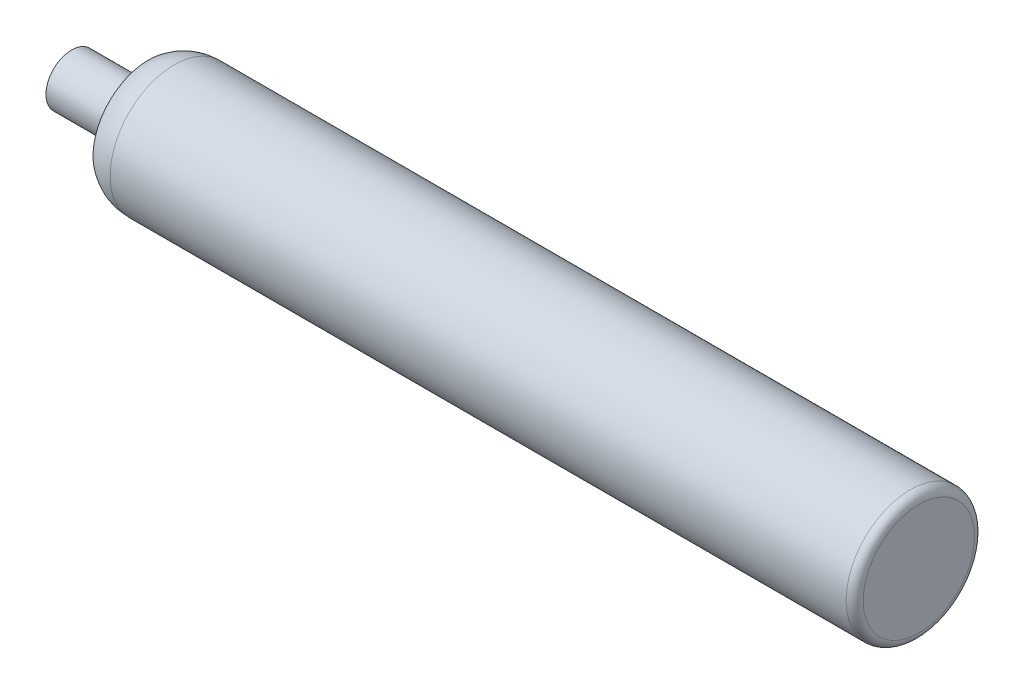
from build123d import *


with BuildPart() as part:
    # Sketch1 → Revolve1 (revolve)
    with BuildSketch(Plane.XY):
        with BuildLine():
            Line((0, 3), (0, 0))
            Line((0, 0), (99, 0))
            Line((99, 0), (99, 6.5))
            ThreePointArc((99, 6.5), (98.707106781, 7.207106781), (98, 7.5))
            Line((98, 7.5), (12, 7.5))
            ThreePointArc((12, 7.5), (10.41886117, 7.24341649), (9, 6.5))
            Line((9, 6.5), (9, 3))
            Line((9, 3), (0, 3))
        make_face()
    revolve(axis=Axis((0, 0, 0), (-1, 0, 0)))


solid = part.part
